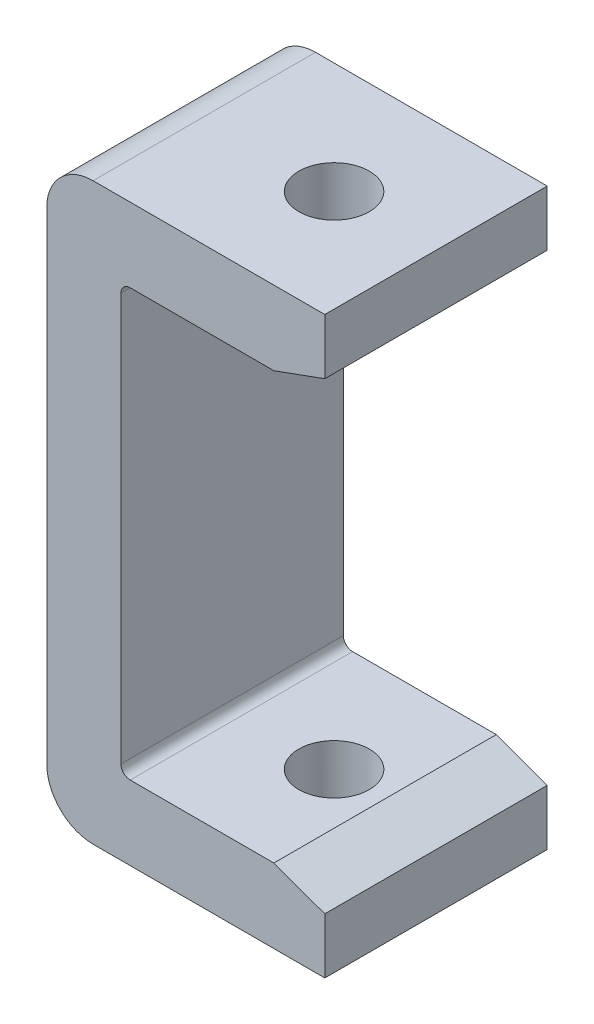
from build123d import *
from OCP.BRepFilletAPI import BRepFilletAPI_MakeChamfer

# Parameters (mm, degrees)
SALIENTE_EXTRUIR1_DEPTH = 12
CROQUIS2_R              = 1.9
CORTAR_EXTRUIR1_DEPTH   = 35.077118423
REDONDEO1_R             = 0.5
REDONDEO2_R             = 2.5
CHAFL_N1_SIZE           = 1
CHAFL_N1_SIZE2          = 2.747477419


with BuildPart() as part:
    # Croquis1 → Saliente-Extruir1 (new body)
    with BuildSketch(Plane.XY):
        Polygon((-3.5, 11.5), (3.5, 11.5), (7.5, 11.5), (7.5, 15.5), (-7.5, 15.5), (-7.5, -15.5), (7.5, -15.5), (7.5, -11.5), (3.5, -11.5), (-3.5, -11.5), align=None)
    extrude(amount=SALIENTE_EXTRUIR1_DEPTH)

    # Croquis2 → Cortar-Extruir1 (cut, through all)
    with BuildSketch(Plane(origin=(0, 15.5, 0), x_dir=(1, 0, 0), z_dir=(0, 1, 0))):
        with Locations(Location((2, -6, 0), (0, 0, 270))):
            Circle(CROQUIS2_R)
    extrude(amount=-CORTAR_EXTRUIR1_DEPTH, mode=Mode.SUBTRACT)

    # Redondeo1
    redondeo1_edges = [part.edges().sort_by_distance(p)[0] for p in [
        (-3.5, 11.5, 6),
        (-3.5, -11.5, 6),
    ]]
    fillet(redondeo1_edges, radius=REDONDEO1_R)

    # Redondeo2
    redondeo2_edges = [part.edges().sort_by_distance(p)[0] for p in [
        (-7.5, -15.5, 6),
        (-7.5, 15.5, 6),
    ]]
    fillet(redondeo2_edges, radius=REDONDEO2_R)

    # Chaflán1: one chamfer whose edges measure the first distance from different faces: ONE call of the kernel's chamfer builder (chamfer() names one face for all edges)
    chafl_n1_edges_1 = [part.edges().sort_by_distance(p)[0] for p in [
        (7.5, -11.5, 6),
    ]]
    chafl_n1_side_1 = [part.faces().sort_by_distance(p)[0] for p in [
        (7.5, -13.5, 6),
    ]]
    chafl_n1_edges_2 = [part.edges().sort_by_distance(p)[0] for p in [
        (7.5, 11.5, 6),
    ]]
    chafl_n1_side_2 = [part.faces().sort_by_distance(p)[0] for p in [
        (7.5, 13.5, 6),
    ]]
    chafl_n1 = BRepFilletAPI_MakeChamfer(part.part.solid().wrapped)
    for e in chafl_n1_edges_1:
        chafl_n1.Add(CHAFL_N1_SIZE, CHAFL_N1_SIZE2, e.wrapped, chafl_n1_side_1[0].wrapped)  # the first distance lies on this face
    for e in chafl_n1_edges_2:
        chafl_n1.Add(CHAFL_N1_SIZE, CHAFL_N1_SIZE2, e.wrapped, chafl_n1_side_2[0].wrapped)  # the first distance lies on this face
    add(Compound.cast(chafl_n1.Shape()), mode=Mode.REPLACE)


solid = part.part
